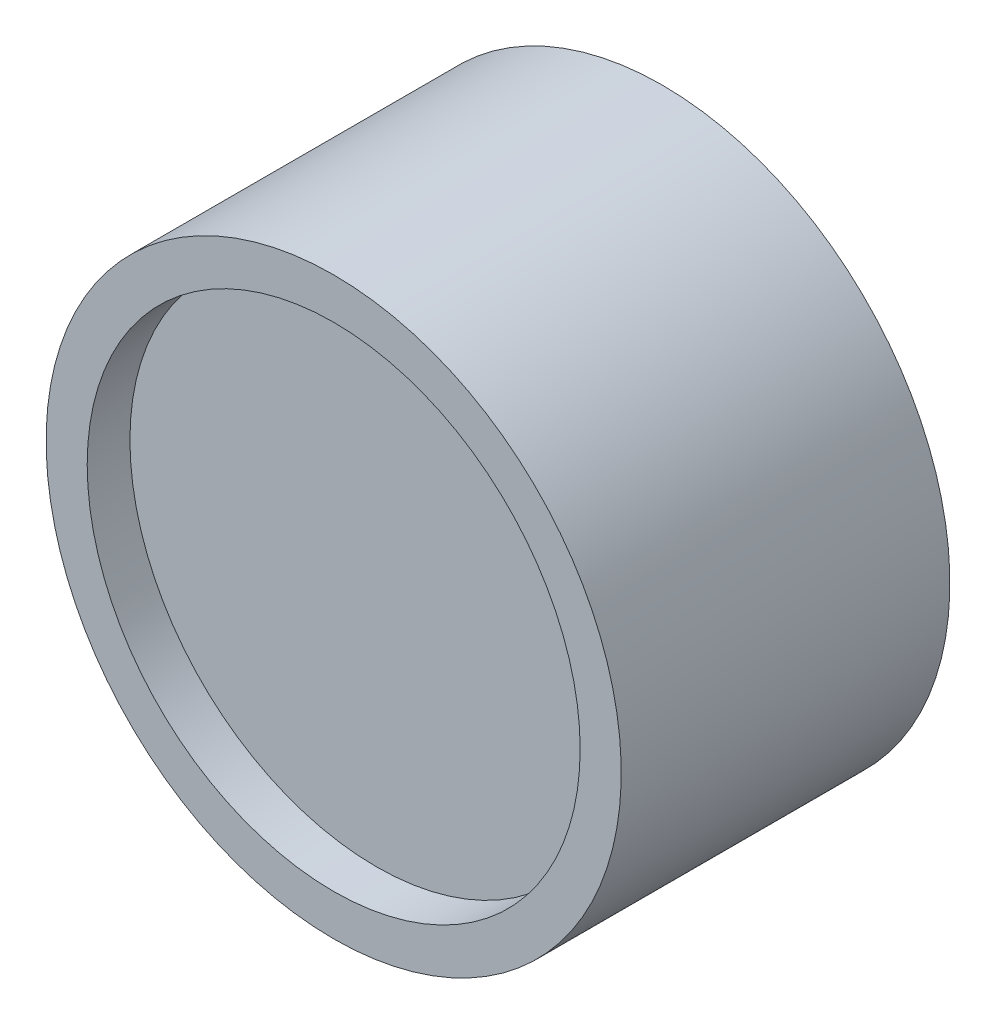
from build123d import *

# Parameters (mm, degrees)
F_1_8_0_125_DIAMETER_HOLE1_D     = 3.175
F_1_8_0_125_DIAMETER_HOLE1_DEPTH = 16.002
F_1_8_0_125_DIAMETER_HOLE1_TIP   = 0.953866233


with BuildPart() as part:
    # Sketch1 → Revolve1 (revolve)
    with BuildSketch(Plane(origin=(0, 0, 0), x_dir=(0, 0, -1), z_dir=(1, 0, 0)), mode=Mode.PRIVATE) as revolve1_sk:
        Polygon((-12.7, 19.05), (-9.398, 19.05), (-9.398, 0), (9.398, 0), (9.398, 19.05), (12.7, 19.05), (12.7, 22.225), (-12.7, 22.225), align=None)
    revolve(revolve1_sk.sketch.rotate(Axis((0, 0, 9.398), (0, 0, -1)), 180), axis=Axis((0, 0, 9.398), (0, 0, -1)))

    # 1/8 (0.125) Diameter Hole1
    with Locations(Plane(origin=(0, -22.225, 0), x_dir=(-1, 0, 0), z_dir=(0, -1, 0))):
        with Locations((0, 0)):
            Hole(F_1_8_0_125_DIAMETER_HOLE1_D / 2, depth=F_1_8_0_125_DIAMETER_HOLE1_DEPTH)
            with Locations((0, 0, -(F_1_8_0_125_DIAMETER_HOLE1_DEPTH + F_1_8_0_125_DIAMETER_HOLE1_TIP / 2))):  # 118° drill point
                Cone(0, F_1_8_0_125_DIAMETER_HOLE1_D / 2, F_1_8_0_125_DIAMETER_HOLE1_TIP, mode=Mode.SUBTRACT)


solid = part.part
